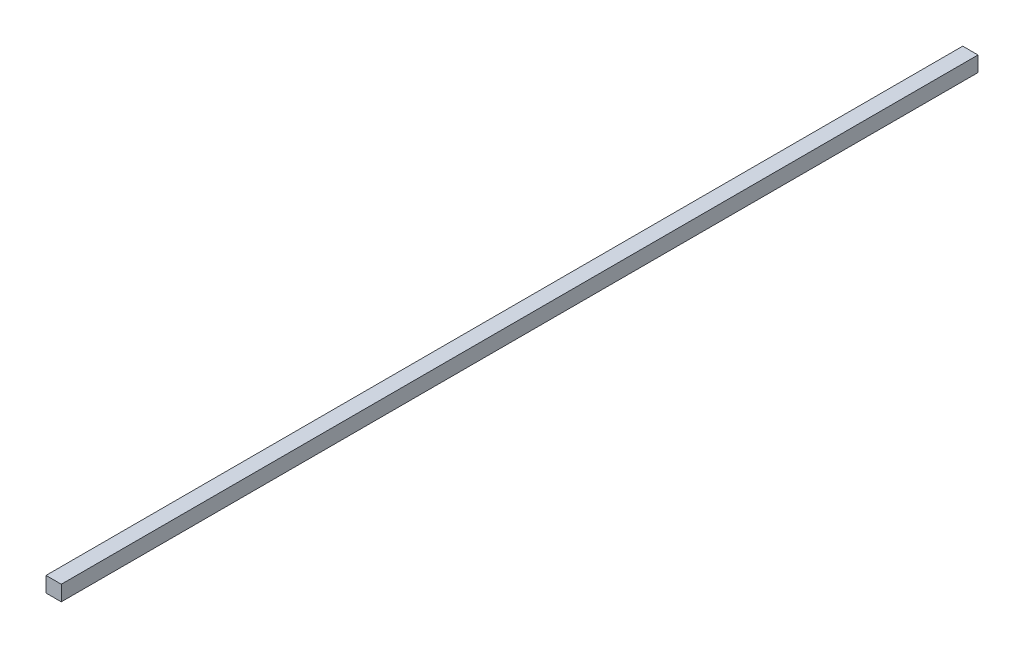
from build123d import *

# Parameters (mm, degrees)
SKETCH1_W           = 25.4
SKETCH1_H           = 25.4
BOSS_EXTRUDE1_DEPTH = 1524


with BuildPart() as part:
    # Sketch1 → Boss-Extrude1 (new body)
    with BuildSketch(Plane.XY):
        with Locations((-12.7, 12.7)):
            Rectangle(SKETCH1_W, SKETCH1_H)
    extrude(amount=BOSS_EXTRUDE1_DEPTH)


solid = part.part
